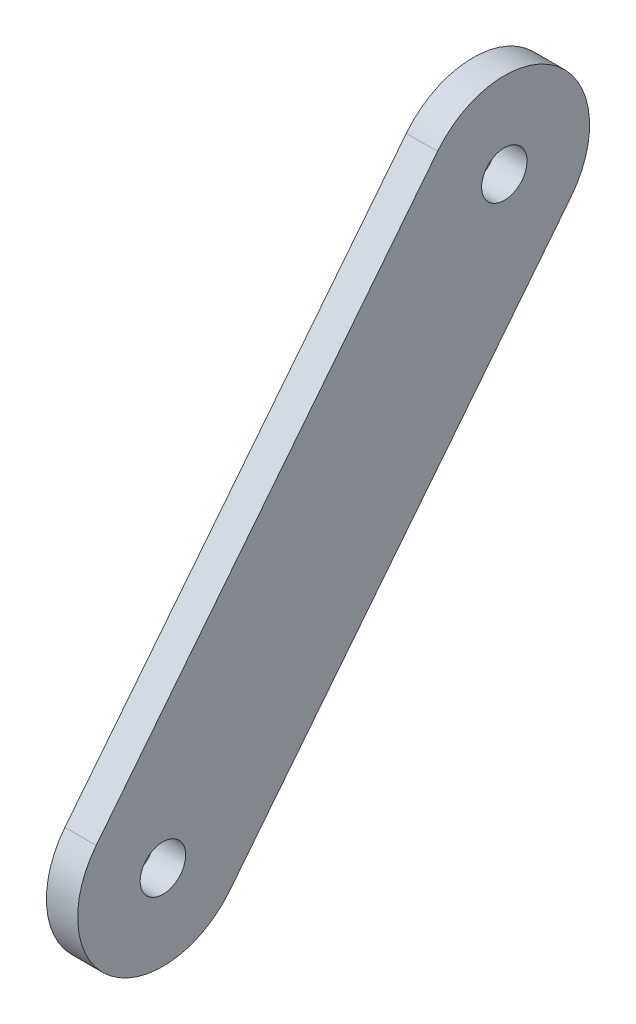
from build123d import *

# Parameters (mm, degrees)
SKETCH_2_R      = 4.000000001
EXTRUDE_2_DEPTH = 5.5


with BuildPart() as part:
    # Эскиз2 → Вытянуть2 (new body)
    with BuildSketch(Plane(origin=(0, 0, 0), x_dir=(0, 0, -1), z_dir=(1, 0, 0))):
        with BuildLine():
            Line((64.879401745, 21.347567696), (124.958095822, 97.069532604))
            ThreePointArc((124.958095822, 97.069532604), (122.530538579, 118.143378143), (101.456693039, 115.715820901))
            Line((101.456693039, 115.715820901), (41.377998963, 39.993855993))
            ThreePointArc((41.377998963, 39.993855993), (43.805556206, 18.920010453), (64.879401745, 21.347567696))
        make_face()
        with Locations((113.20739443, 106.392676752)):
            Circle(SKETCH_2_R, mode=Mode.SUBTRACT)
        with Locations((53.128700354, 30.670711845)):
            Circle(SKETCH_2_R, mode=Mode.SUBTRACT)
    extrude(amount=EXTRUDE_2_DEPTH)


solid = part.part
